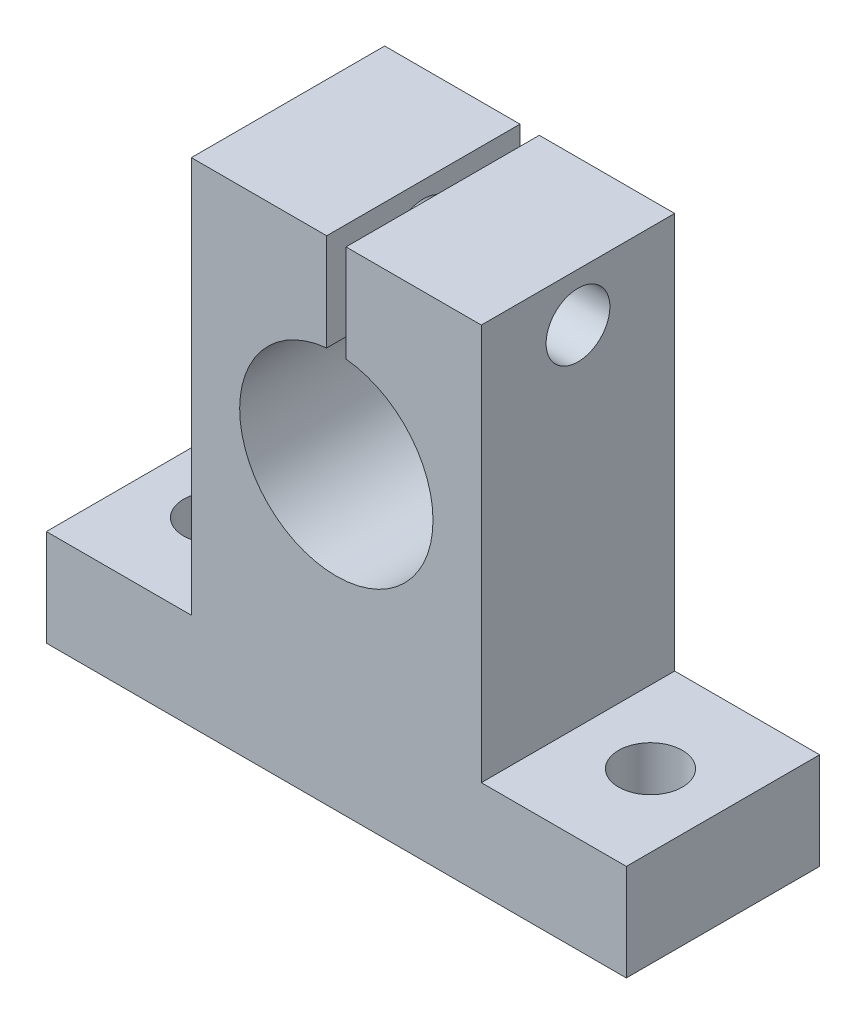
from build123d import *

# Parameters (mm, degrees)
BOSS_EXTRUDE1_DEPTH = 10
SKETCH3_R           = 10
CUT_EXTRUDE1_DEPTH  = 26
SKETCH9_R           = 3.3
CUT_EXTRUDE2_DEPTH  = 26
SKETCH10_R          = 3.3
CUT_EXTRUDE3_DEPTH  = 26
SKETCH12_R          = 3.3
CUT_EXTRUDE5_DEPTH  = 46
SKETCH15_W          = 2
SKETCH15_H          = 20
CUT_EXTRUDE7_DEPTH  = 15


with BuildPart() as part:
    # Sketch2 → Boss-Extrude1 (new, symmetric)
    with BuildSketch(Plane.XY):
        Polygon((45, 10), (60, 10), (60, 0), (0, 0), (0, 10), (15, 10), (15, 51), (45, 51), align=None)
    extrude(amount=BOSS_EXTRUDE1_DEPTH, both=True)

    # Sketch3 → Cut-Extrude1 (cut)
    with BuildSketch(Plane.XY.offset(10)):
        with Locations((30, 31)):
            Circle(SKETCH3_R)
    extrude(amount=-CUT_EXTRUDE1_DEPTH, mode=Mode.SUBTRACT)

    # Sketch9 → Cut-Extrude2 (cut)
    with BuildSketch(Plane(origin=(0, 10, 0), x_dir=(1, 0, 0), z_dir=(0, 1, 0))):
        with Locations(Location((7.5, 0, 0), (0, 0, 270))):
            Circle(SKETCH9_R)
    extrude(amount=-CUT_EXTRUDE2_DEPTH, mode=Mode.SUBTRACT)

    # Sketch10 → Cut-Extrude3 (cut)
    with BuildSketch(Plane(origin=(0, 10, 0), x_dir=(1, 0, 0), z_dir=(0, 1, 0))):
        with Locations(Location((52.5, 0, 0), (0, 0, 270))):
            Circle(SKETCH10_R)
    extrude(amount=-CUT_EXTRUDE3_DEPTH, mode=Mode.SUBTRACT)

    # Sketch12 → Cut-Extrude5 (cut)
    with BuildSketch(Plane.ZY.offset(-15)):
        with Locations((0, 46)):
            Circle(SKETCH12_R)
    extrude(amount=-CUT_EXTRUDE5_DEPTH, mode=Mode.SUBTRACT)

    # Sketch15 → Cut-Extrude7 (cut)
    with BuildSketch(Plane(origin=(0, 51, 0), x_dir=(1, 0, 0), z_dir=(0, 1, 0))):
        with Locations((30, 0)):
            Rectangle(SKETCH15_W, SKETCH15_H)
    extrude(amount=-CUT_EXTRUDE7_DEPTH, mode=Mode.SUBTRACT)


solid = part.part
